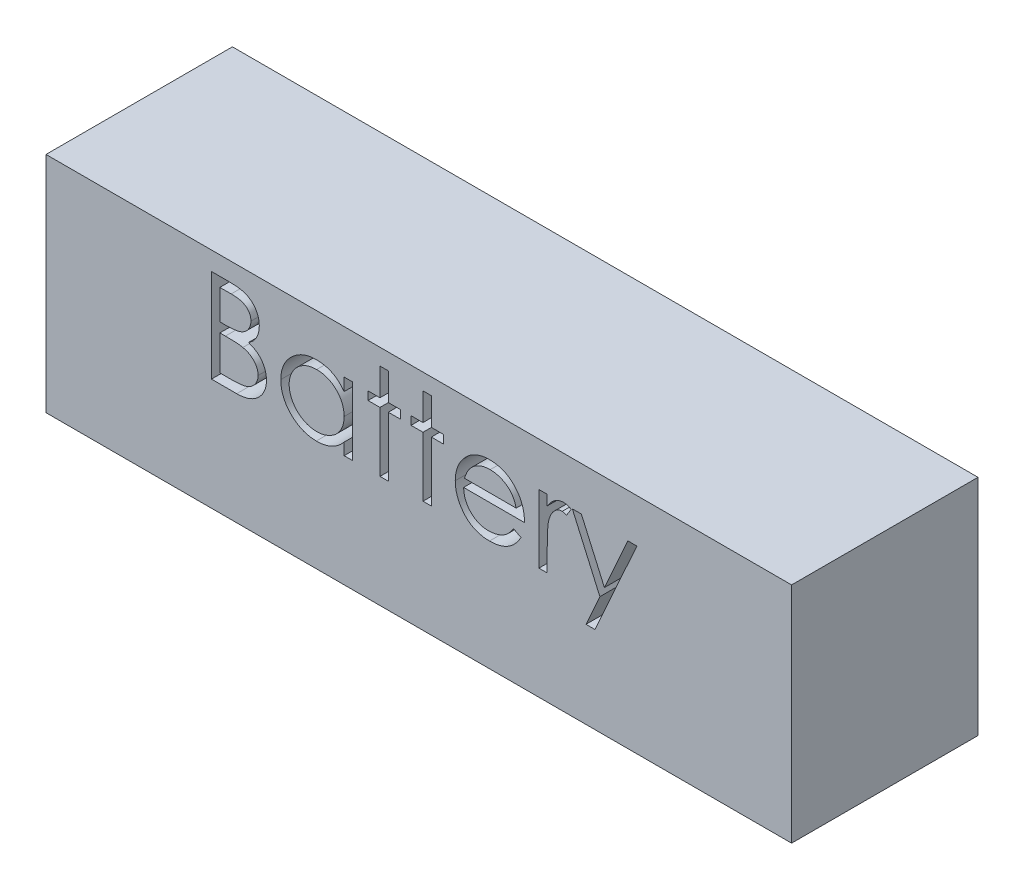
from build123d import *

# Parameters (mm, degrees)
SKETCH1_W           = 101.6
SKETCH1_H           = 30.48
BOSS_EXTRUDE1_DEPTH = 25.4
CUT_EXTRUDE1_DEPTH  = 78.488992395


with BuildPart() as part:
    # Sketch1 → Boss-Extrude1 (new body)
    with BuildSketch(Plane.XY):
        with Locations((3.946640292, 33.362359192)):
            Rectangle(SKETCH1_W, SKETCH1_H)
    extrude(amount=BOSS_EXTRUDE1_DEPTH)

    # Sketch2 → Cut-Extrude1 (cut, through all)
    # profile 1 of 7: a face of its own
    with BuildSketch(Plane.XY.offset(25.4)):
        with BuildLine():
            Line((-24.302718682, 46.062359192), (-21.824794003, 46.062359192))
            add(Edge.make_bspline(
                [(-21.824794003, 46.062359192), (-21.703496382, 46.061721469), (-21.468391404, 46.060485403), (-21.12650943, 46.041315185), (-20.806292317, 46.015176154), (-20.5076472, 45.973701246), (-20.23071208, 45.923656798), (-19.974652368, 45.863053065), (-19.740282314, 45.790385067), (-19.460473242, 45.674828561), (-19.141446844, 45.503113064), (-18.796012676, 45.249372271), (-18.500631579, 44.939011619), (-18.245955513, 44.588917412), (-18.043477165, 44.203796183), (-17.896994286, 43.792827127), (-17.80425571, 43.361311092), (-17.794718249, 43.065062989), (-17.789898169, 42.915343968)],
                knots=[0, 0, 0, 0, 1.001505555, 1.941167018, 2.826882275, 3.653841531, 4.429895133, 5.150066043, 5.825578002, 6.45369114, 7.647487171, 8.808567382, 9.977351308, 11.170798116, 12.373658725, 13.556498008, 14.765093433, 16, 16, 16, 16], degree=3))
            add(Edge.make_bspline(
                [(-17.789898169, 42.915343968), (-17.79386499, 42.775090409), (-17.801660168, 42.499478938), (-17.876201038, 42.096366027), (-17.99289832, 41.712640176), (-18.15511451, 41.349701806), (-18.365941754, 41.015751267), (-18.615799081, 40.708094616), (-18.917249193, 40.439757924), (-19.143103235, 40.289742249), (-19.257826855, 40.213541083)],
                knots=[0, 0, 0, 0, 1.044552857, 2.05264487, 3.044412934, 4.028983338, 5.005914585, 5.980388656, 6.974128949, 8, 8, 8, 8], degree=3))
            add(Edge.make_bspline(
                [(-19.257826855, 40.213541083), (-19.113553304, 40.158150944), (-18.83752226, 40.052175887), (-18.457661587, 39.864812918), (-18.130383149, 39.661024688), (-17.853170648, 39.438477689), (-17.6160883, 39.198597147), (-17.409067626, 38.937865733), (-17.232423783, 38.65288224), (-17.08106546, 38.346617983), (-16.962959974, 38.022200226), (-16.874510264, 37.682671982), (-16.823828377, 37.329250739), (-16.816616079, 37.088729505), (-16.812975092, 36.967307109)],
                knots=[0, 0, 0, 0, 1.27268992, 2.434971085, 3.483601985, 4.442670788, 5.356604649, 6.2567628, 7.179492994, 8.113709626, 9.066344395, 10.018646069, 10.999752585, 12, 12, 12, 12], degree=3))
            add(Edge.make_bspline(
                [(-16.812975092, 36.967307109), (-16.816519648, 36.843330173), (-16.82349366, 36.599402078), (-16.874946701, 36.241062018), (-16.96206546, 35.898615783), (-17.082066477, 35.569848406), (-17.238684019, 35.255395918), (-17.429285489, 34.954902075), (-17.656548592, 34.671386075), (-17.910776716, 34.4016975), (-18.198385073, 34.1592081), (-18.508685098, 33.943251107), (-18.845584601, 33.765646825), (-19.203550408, 33.616454404), (-19.586598069, 33.502491141), (-19.99300753, 33.422762087), (-20.422428283, 33.369040953), (-20.717103665, 33.364624238), (-20.86822349, 33.362359192)],
                knots=[0, 0, 0, 0, 0.978564426, 1.925352924, 2.850884081, 3.763762016, 4.682927383, 5.618979971, 6.567305752, 7.547517671, 8.540179244, 9.531824382, 10.526200242, 11.540722885, 12.589160233, 13.674978461, 14.80764778, 16, 16, 16, 16], degree=3))
            Line((-20.86822349, 33.362359192), (-24.302718682, 33.362359192))
            Line((-24.302718682, 33.362359192), (-24.302718682, 46.062359192))
        make_face()
        with BuildLine():
            Line((-23.162975092, 44.759795089), (-23.162975092, 40.689282269))
            Line((-23.162975092, 40.689282269), (-22.397209868, 40.689282269))
            add(Edge.make_bspline(
                [(-22.397209868, 40.689282269), (-22.285272811, 40.690733418), (-22.068987604, 40.693537334), (-21.755769694, 40.701569239), (-21.465030342, 40.724059282), (-21.197271405, 40.746542862), (-20.952914537, 40.783099223), (-20.732501096, 40.826613497), (-20.532571902, 40.872634324), (-20.302014122, 40.950900748), (-20.040492281, 41.066571169), (-19.761697874, 41.246083261), (-19.515918513, 41.459894485), (-19.308374432, 41.706604546), (-19.138515668, 41.978261849), (-19.02053733, 42.270531958), (-18.940537184, 42.576130723), (-18.93331077, 42.785928383), (-18.929641759, 42.892447333)],
                knots=[0, 0, 0, 0, 1.156816544, 2.235205308, 3.236616184, 4.169592532, 5.011045266, 5.787822928, 6.49130361, 7.128639758, 8.301311294, 9.436451833, 10.541879658, 11.654887649, 12.756523258, 13.837046038, 14.901820046, 16, 16, 16, 16], degree=3))
            add(Edge.make_bspline(
                [(-18.929641759, 42.892447333), (-18.931551041, 42.962935133), (-18.935296307, 43.101204648), (-18.96596972, 43.302769448), (-19.01810349, 43.492339636), (-19.085066211, 43.672513122), (-19.17864231, 43.837656121), (-19.288818305, 43.993478574), (-19.421934953, 44.134673975), (-19.573454345, 44.266643298), (-19.747657062, 44.38364487), (-19.944439178, 44.486118496), (-20.166463035, 44.568635029), (-20.409986823, 44.640902211), (-20.678759055, 44.691659734), (-20.969678148, 44.733944884), (-21.285126986, 44.755472262), (-21.503367787, 44.758322007), (-21.616180221, 44.759795089)],
                knots=[0, 0, 0, 0, 0.91205012, 1.789085906, 2.630437955, 3.453916878, 4.269457761, 5.079663411, 5.91843418, 6.774407191, 7.675494373, 8.627863946, 9.638891023, 10.736472738, 11.911756761, 13.175263542, 14.539845004, 16, 16, 16, 16], degree=3))
            Line((-21.616180221, 44.759795089), (-23.162975092, 44.759795089))
        make_face(mode=Mode.SUBTRACT)
        with BuildLine():
            Line((-23.162975092, 39.386718166), (-23.162975092, 34.664923295))
            Line((-23.162975092, 34.664923295), (-21.539858105, 34.664923295))
            add(Edge.make_bspline(
                [(-21.539858105, 34.664923295), (-21.423675145, 34.666315749), (-21.199747807, 34.668999523), (-20.876437629, 34.677760906), (-20.576778938, 34.697690021), (-20.302139132, 34.729062104), (-20.049552632, 34.763092477), (-19.822049538, 34.80885341), (-19.617785665, 34.861282496), (-19.380933177, 34.942323635), (-19.114220447, 35.068222258), (-18.826798196, 35.258048165), (-18.571251633, 35.484192739), (-18.354243979, 35.745924913), (-18.176396849, 36.030518585), (-18.047018483, 36.332217427), (-17.967223089, 36.646036341), (-17.957563217, 36.860001269), (-17.952718682, 36.967307109)],
                knots=[0, 0, 0, 0, 1.160039823, 2.235823828, 3.228722157, 4.157150951, 4.99529583, 5.772374946, 6.472645482, 7.099169577, 8.269452708, 9.405989375, 10.527446681, 11.663510218, 12.788923519, 13.866172445, 14.929861265, 16, 16, 16, 16], degree=3))
            add(Edge.make_bspline(
                [(-17.952718682, 36.967307109), (-17.953720546, 37.034411516), (-17.955708115, 37.16753793), (-17.985682346, 37.363175331), (-18.029275531, 37.552680642), (-18.085632448, 37.736568444), (-18.1677088, 37.911514123), (-18.263526835, 38.080977697), (-18.375872492, 38.245183179), (-18.550929894, 38.452781927), (-18.805553952, 38.691966517), (-19.167347109, 38.926145454), (-19.57872659, 39.11500464), (-19.877094921, 39.195194168), (-20.031224291, 39.236618006)],
                knots=[0, 0, 0, 0, 0.723448775, 1.435228256, 2.130040452, 2.821711965, 3.505591119, 4.210454504, 4.921174351, 5.648778258, 7.137944449, 8.670945889, 10.280296675, 12, 12, 12, 12], degree=3))
            add(Edge.make_bspline(
                [(-20.031224291, 39.236618006), (-20.093015582, 39.249155025), (-20.226991845, 39.276337868), (-20.445459352, 39.305031535), (-20.694872362, 39.330595038), (-20.975806802, 39.349504095), (-21.288618111, 39.369049554), (-21.633974359, 39.376650762), (-22.010465186, 39.385719505), (-22.271694652, 39.386376764), (-22.40738615, 39.386718166)],
                knots=[0, 0, 0, 0, 0.634451884, 1.375622551, 2.216452059, 3.157844607, 4.20941857, 5.370758133, 6.634282058, 8, 8, 8, 8], degree=3))
            Line((-22.40738615, 39.386718166), (-23.162975092, 39.386718166))
        make_face(mode=Mode.SUBTRACT)
    # profile 2 of 7: a face of its own
    with BuildSketch(Plane.XY.offset(25.4)):
        with BuildLine():
            Line((-5.089898169, 42.643128423), (-5.089898169, 33.362359192))
            Line((-5.089898169, 33.362359192), (-6.229641759, 33.362359192))
            Line((-6.229641759, 33.362359192), (-6.229641759, 34.967667686))
            add(Edge.make_bspline(
                [(-6.229641759, 34.967667686), (-6.358161371, 34.822381159), (-6.608969009, 34.538852675), (-7.027855351, 34.168440221), (-7.471877025, 33.862267454), (-7.938878962, 33.614980617), (-8.428439445, 33.429226584), (-8.939473248, 33.297196807), (-9.47218883, 33.212310605), (-9.83596166, 33.203834183), (-10.020306823, 33.199538679)],
                knots=[0, 0, 0, 0, 1.074387032, 2.096679803, 3.090159297, 4.057316773, 5.018401886, 5.985159533, 6.978961417, 8, 8, 8, 8], degree=3))
            add(Edge.make_bspline(
                [(-10.020306823, 33.199538679), (-10.18420197, 33.203988659), (-10.507410456, 33.212764215), (-10.982858822, 33.280844574), (-11.440393556, 33.390175687), (-11.880447005, 33.542216057), (-12.300171647, 33.743895038), (-12.703161141, 33.98534471), (-13.087327766, 34.272875722), (-13.446815922, 34.601580853), (-13.777857751, 34.958614093), (-14.068365798, 35.339416506), (-14.310584116, 35.742341437), (-14.513131266, 36.162287452), (-14.669146573, 36.602487303), (-14.777908046, 37.061418741), (-14.845909096, 37.538539139), (-14.854681024, 37.863439695), (-14.859128939, 38.028184513)],
                knots=[0, 0, 0, 0, 1.033919861, 2.038935746, 3.024066025, 3.998881131, 4.97069526, 5.957263378, 6.95902576, 7.993208707, 9.027059324, 10.027763471, 11.009749337, 11.988697705, 12.965288445, 13.950418724, 14.960734635, 16, 16, 16, 16], degree=3))
            add(Edge.make_bspline(
                [(-14.859128939, 38.028184513), (-14.854582442, 38.189524237), (-14.845594265, 38.508484168), (-14.778635438, 38.977581158), (-14.666037207, 39.429404561), (-14.508020731, 39.862499755), (-14.305394209, 40.277390795), (-14.058912293, 40.674371114), (-13.768557184, 41.054534356), (-13.433812735, 41.408941379), (-13.071192283, 41.736313322), (-12.683266317, 42.020826144), (-12.279684696, 42.266541567), (-11.854187487, 42.461227038), (-11.413072563, 42.618740075), (-10.952412917, 42.727716845), (-10.474125189, 42.791932839), (-10.149402546, 42.801232012), (-9.984689836, 42.805948936)],
                knots=[0, 0, 0, 0, 1.020392517, 2.01726096, 2.990465484, 3.961182959, 4.928053699, 5.906110375, 6.912531644, 7.948652711, 8.985773172, 9.998621852, 10.987621588, 11.969261332, 12.953316658, 13.946091881, 14.958173133, 16, 16, 16, 16], degree=3))
            add(Edge.make_bspline(
                [(-9.984689836, 42.805948936), (-9.795278919, 42.800731951), (-9.42385305, 42.790501692), (-8.880554273, 42.70536551), (-8.366587168, 42.5615345), (-7.877984233, 42.365891008), (-7.416500029, 42.105908476), (-6.986503486, 41.777958332), (-6.583494447, 41.384108882), (-6.34988596, 41.081593269), (-6.229641759, 40.925880827)],
                knots=[0, 0, 0, 0, 1.038897134, 2.037228247, 3.008116434, 3.962042015, 4.918381754, 5.904844433, 6.921570401, 8, 8, 8, 8], degree=3))
            Line((-6.229641759, 40.925880827), (-6.229641759, 42.643128423))
            Line((-6.229641759, 42.643128423), (-5.089898169, 42.643128423))
        make_face()
        with BuildLine():
            add(Edge.make_bspline(
                [(-9.969425413, 41.666205346), (-10.136028867, 41.660277575), (-10.464877587, 41.648577097), (-10.947637252, 41.557233272), (-11.409603069, 41.405252029), (-11.848464538, 41.197400559), (-12.25728921, 40.936039144), (-12.622663387, 40.619912982), (-12.947575475, 40.257647244), (-13.220836891, 39.85087673), (-13.443596694, 39.414801942), (-13.600231353, 38.958964695), (-13.70353405, 38.491586634), (-13.714087825, 38.174584888), (-13.719385349, 38.01546416)],
                knots=[0, 0, 0, 0, 1.031046209, 2.035121221, 3.029706178, 4.034933723, 5.034054252, 6.02443088, 7.017295772, 8.038157696, 9.050218397, 10.03989886, 11.016116709, 12, 12, 12, 12], degree=3))
            add(Edge.make_bspline(
                [(-13.719385349, 38.01546416), (-13.71261845, 37.857294342), (-13.699111177, 37.54157468), (-13.602044372, 37.073559444), (-13.439194545, 36.617614777), (-13.216973346, 36.177610601), (-12.938710451, 35.769091151), (-12.616171626, 35.399919849), (-12.246237748, 35.082457629), (-11.836472222, 34.816709862), (-11.398837587, 34.602034429), (-10.938611607, 34.452661965), (-10.46444572, 34.35622259), (-10.14203868, 34.344957774), (-9.979601695, 34.339282269)],
                knots=[0, 0, 0, 0, 0.979072187, 1.954306742, 2.945804271, 3.96968567, 4.997920485, 5.998718438, 6.996577872, 8.005894225, 9.015743152, 10.005417472, 10.995077863, 12, 12, 12, 12], degree=3))
            add(Edge.make_bspline(
                [(-9.979601695, 34.339282269), (-9.814695813, 34.345305567), (-9.486714371, 34.357285308), (-9.002522488, 34.449020185), (-8.532640766, 34.600581254), (-8.083469966, 34.810672371), (-7.665037147, 35.071049062), (-7.289487705, 35.375874792), (-6.971929763, 35.730397775), (-6.70271658, 36.120020904), (-6.491622925, 36.547147291), (-6.337858367, 37.001931355), (-6.246948481, 37.484388927), (-6.235490433, 37.814095176), (-6.229641759, 37.982391243)],
                knots=[0, 0, 0, 0, 1.01762866, 2.023962475, 3.030623092, 4.058876274, 5.077231937, 6.066672613, 7.034107872, 8.005628644, 8.981990164, 9.965428785, 10.961468474, 12, 12, 12, 12], degree=3))
            add(Edge.make_bspline(
                [(-6.229641759, 37.982391243), (-6.233123941, 38.110617085), (-6.239977976, 38.363006121), (-6.292340329, 38.733583113), (-6.375633919, 39.088216919), (-6.493004307, 39.427280391), (-6.647186968, 39.748898875), (-6.833143147, 40.055381662), (-7.054142921, 40.345134743), (-7.306628704, 40.614168172), (-7.582999582, 40.859555621), (-7.87544263, 41.07859158), (-8.187422654, 41.258527984), (-8.513693045, 41.407449169), (-8.854819888, 41.525955228), (-9.213578994, 41.605013431), (-9.586157032, 41.659298024), (-9.840324147, 41.663878663), (-9.969425413, 41.666205346)],
                knots=[0, 0, 0, 0, 1.050140795, 2.067009409, 3.05949893, 4.030605086, 5.00011959, 5.97591094, 6.962425594, 7.979863591, 8.993523472, 9.986985069, 10.967611495, 11.937549037, 12.921786183, 13.919465291, 14.943216303, 16, 16, 16, 16], degree=3))
        make_face(mode=Mode.SUBTRACT)
    # profile 3 of 7: a face of its own
    with BuildSketch(Plane.XY.offset(25.4)):
        Polygon((-1.345026374, 46.388000218), (-0.205282785, 46.388000218), (-0.205282785, 42.643128423), (1.422922344, 42.643128423), (1.422922344, 41.503384833), (-0.205282785, 41.503384833), (-0.205282785, 33.362359192), (-1.345026374, 33.362359192), (-1.345026374, 41.503384833), (-2.973231503, 41.503384833), (-2.973231503, 42.643128423), (-1.345026374, 42.643128423), align=None)
    # profile 4 of 7: a face of its own
    with BuildSketch(Plane.XY.offset(25.4)):
        Polygon((4.516512087, 46.388000218), (5.656255677, 46.388000218), (5.656255677, 42.643128423), (7.284460805, 42.643128423), (7.284460805, 41.503384833), (5.656255677, 41.503384833), (5.656255677, 33.362359192), (4.516512087, 33.362359192), (4.516512087, 41.503384833), (2.888306959, 41.503384833), (2.888306959, 42.643128423), (4.516512087, 42.643128423), align=None)
    # profile 5 of 7: a face of its own
    with BuildSketch(Plane.XY.offset(25.4)):
        with BuildLine():
            Line((16.855254074, 36.293128423), (17.867794138, 35.761417686))
            add(Edge.make_bspline(
                [(17.867794138, 35.761417686), (17.787107064, 35.618294741), (17.630121971, 35.339834168), (17.360153543, 34.957267131), (17.077153736, 34.613105419), (16.76834791, 34.316543531), (16.442975075, 34.058002791), (16.09923087, 33.831805541), (15.735325731, 33.639061196), (15.351242444, 33.476673452), (14.943755502, 33.351816145), (14.511877428, 33.263626543), (14.054780859, 33.20911354), (13.741467578, 33.202781172), (13.581035324, 33.199538679)],
                knots=[0, 0, 0, 0, 1.120438281, 2.179929193, 3.190490725, 4.156257408, 5.095198341, 6.022838206, 6.959905092, 7.901321166, 8.864066838, 9.862729781, 10.905609505, 12, 12, 12, 12], degree=3))
            add(Edge.make_bspline(
                [(13.581035324, 33.199538679), (13.402720149, 33.203701287), (13.054878899, 33.211821328), (12.54854896, 33.281825414), (12.071829356, 33.396025115), (11.624746889, 33.555557223), (11.20839643, 33.76393637), (10.821950471, 34.017789347), (10.463376763, 34.3158121), (10.143974632, 34.660586052), (9.856432544, 35.029546297), (9.602701711, 35.414014792), (9.390584747, 35.813024207), (9.218036705, 36.224034394), (9.078681909, 36.644454808), (8.981557012, 37.078110704), (8.92556907, 37.523828396), (8.91698951, 37.825353014), (8.912665933, 37.977303102)],
                knots=[0, 0, 0, 0, 1.145258523, 2.234067595, 3.276747158, 4.290159414, 5.277019952, 6.260822364, 7.254936242, 8.264827045, 9.274100331, 10.257902744, 11.220704747, 12.172965371, 13.118907548, 14.062713208, 15.023725156, 16, 16, 16, 16], degree=3))
            add(Edge.make_bspline(
                [(8.912665933, 37.977303102), (8.916509103, 38.119887201), (8.924125759, 38.402470056), (8.972134616, 38.820719318), (9.057218422, 39.22722256), (9.173972512, 39.622317556), (9.324744176, 40.005342786), (9.509192515, 40.376531359), (9.727604857, 40.735488295), (9.896234273, 40.961922523), (9.981175549, 41.075980987)],
                knots=[0, 0, 0, 0, 1.024358464, 2.0301432, 3.019427413, 4.004406732, 4.986367066, 5.972626655, 6.978780325, 8, 8, 8, 8], degree=3))
            add(Edge.make_bspline(
                [(9.981175549, 41.075980987), (10.09622914, 41.213390887), (10.322691718, 41.48385789), (10.705710493, 41.839234101), (11.12045692, 42.136935799), (11.561733392, 42.38370455), (12.034668598, 42.571206069), (12.532905168, 42.710933582), (13.062116295, 42.789230936), (13.423903811, 42.800290218), (13.6090201, 42.805948936)],
                knots=[0, 0, 0, 0, 1.030682036, 2.02871468, 2.997146059, 3.962720338, 4.930598197, 5.918074684, 6.934738563, 8, 8, 8, 8], degree=3))
            add(Edge.make_bspline(
                [(13.6090201, 42.805948936), (13.799329982, 42.801035673), (14.172674589, 42.79139697), (14.717076856, 42.70203856), (15.232191457, 42.560333577), (15.717812258, 42.360204108), (16.173988495, 42.101996592), (16.597755018, 41.782167624), (16.996359078, 41.410536279), (17.228255921, 41.124738348), (17.346259683, 40.979306307)],
                knots=[0, 0, 0, 0, 1.056321875, 2.072262726, 3.055038591, 4.01806755, 4.982017516, 5.957941055, 6.960871419, 8, 8, 8, 8], degree=3))
            add(Edge.make_bspline(
                [(17.346259683, 40.979306307), (17.426548859, 40.869710455), (17.586592783, 40.651248253), (17.787060832, 40.295027197), (17.961077665, 39.922334469), (18.100171552, 39.527145677), (18.212800599, 39.1141432), (18.29428677, 38.680374538), (18.342073672, 38.22596886), (18.351466945, 37.916355358), (18.356255677, 37.758513038)],
                knots=[0, 0, 0, 0, 0.94817472, 1.890038105, 2.849395472, 3.817997239, 4.812318967, 5.836947057, 6.897266129, 8, 8, 8, 8], degree=3))
            Line((18.356255677, 37.758513038), (10.052409523, 37.758513038))
            add(Edge.make_bspline(
                [(10.052409523, 37.758513038), (10.057996095, 37.636228496), (10.068981863, 37.395760877), (10.120199668, 37.043895464), (10.200930933, 36.708712194), (10.314392961, 36.392725156), (10.451795513, 36.091807265), (10.6201094, 35.808190731), (10.820912924, 35.543167385), (11.044889034, 35.294366628), (11.294197637, 35.072803295), (11.556480748, 34.874495421), (11.835494541, 34.708286541), (12.129039015, 34.573376656), (12.436639493, 34.467762309), (12.758392887, 34.395670502), (13.093666052, 34.347384715), (13.322214286, 34.342015644), (13.438567376, 34.339282269)],
                knots=[0, 0, 0, 0, 1.094153842, 2.151609401, 3.174256925, 4.172055639, 5.149267565, 6.128595816, 7.11444997, 8.118368179, 9.117203808, 10.09244225, 11.054858984, 12.015122123, 12.976791628, 13.957293641, 14.960065497, 16, 16, 16, 16], degree=3))
            add(Edge.make_bspline(
                [(13.438567376, 34.339282269), (13.552327254, 34.341488646), (13.778048675, 34.345866521), (14.114202643, 34.388436598), (14.444908929, 34.457271598), (14.768798782, 34.551215276), (15.079298709, 34.66579414), (15.366846848, 34.80405308), (15.631297916, 34.956996447), (15.878465194, 35.131928697), (16.118208513, 35.346044118), (16.356034107, 35.613236591), (16.611037963, 35.929239906), (16.770657343, 36.167077037), (16.855254074, 36.293128423)],
                knots=[0, 0, 0, 0, 0.99110716, 1.966546729, 2.947904876, 3.932708344, 4.903319531, 5.828989031, 6.710028674, 7.56322171, 8.463672341, 9.504779593, 10.677557249, 12, 12, 12, 12], degree=3))
        make_face()
        with BuildLine():
            add(Edge.make_bspline(
                [(17.216512087, 38.898256628), (17.174795764, 39.049433341), (17.09450527, 39.34039985), (16.926733319, 39.743319653), (16.737788014, 40.101415751), (16.51418916, 40.411947562), (16.260846927, 40.687731738), (15.968220122, 40.928736318), (15.640067022, 41.144336783), (15.278083855, 41.32631871), (14.894755092, 41.481221912), (14.493412624, 41.585090189), (14.083900079, 41.656244814), (13.806915669, 41.662870979), (13.667533722, 41.666205346)],
                knots=[0, 0, 0, 0, 1.154881502, 2.222775134, 3.210006277, 4.132804581, 5.035138423, 5.962687519, 6.919655026, 7.923214229, 8.944639381, 9.960483929, 10.97369054, 12, 12, 12, 12], degree=3))
            add(Edge.make_bspline(
                [(13.667533722, 41.666205346), (13.553780045, 41.663985852), (13.328912941, 41.659598379), (12.997620494, 41.617978196), (12.679468443, 41.549181044), (12.372109257, 41.454965345), (12.079570677, 41.329385558), (11.795835376, 41.182126422), (11.528117938, 41.002361246), (11.360690951, 40.865350544), (11.27610744, 40.796133231)],
                knots=[0, 0, 0, 0, 1.04873581, 2.073130211, 3.073294108, 4.04793562, 5.032784715, 6.005352987, 6.992311501, 8, 8, 8, 8], degree=3))
            add(Edge.make_bspline(
                [(11.27610744, 40.796133231), (11.215534674, 40.741362428), (11.092950158, 40.630519673), (10.929154552, 40.439550837), (10.772325979, 40.233623741), (10.629601011, 40.004860003), (10.498690911, 39.755864605), (10.376190423, 39.488737757), (10.265931156, 39.201452398), (10.203896699, 39.001255262), (10.171980837, 38.898256628)],
                knots=[0, 0, 0, 0, 0.879870761, 1.780643979, 2.707998968, 3.669668524, 4.684282772, 5.740141944, 6.837334558, 8, 8, 8, 8], degree=3))
            Line((10.171980837, 38.898256628), (17.216512087, 38.898256628))
        make_face(mode=Mode.SUBTRACT)
    # profile 6 of 7: a face of its own
    with BuildSketch(Plane.XY.offset(25.4)):
        with BuildLine():
            Line((20.310101831, 42.643128423), (21.44984542, 42.643128423))
            Line((21.44984542, 42.643128423), (21.44984542, 41.276962557))
            add(Edge.make_bspline(
                [(21.44984542, 41.276962557), (21.533987488, 41.404165134), (21.694908538, 41.647439075), (21.962381168, 41.969181967), (22.236350398, 42.235573708), (22.518127792, 42.447857904), (22.809785469, 42.606836935), (23.104922408, 42.723288805), (23.40818197, 42.792149349), (23.611969524, 42.801342912), (23.714068177, 42.805948936)],
                knots=[0, 0, 0, 0, 1.2804753, 2.448899062, 3.506932113, 4.484331642, 5.4025378, 6.288909075, 7.142734305, 8, 8, 8, 8], degree=3))
            add(Edge.make_bspline(
                [(23.714068177, 42.805948936), (23.793266562, 42.801629025), (23.956222385, 42.792740528), (24.202902068, 42.730289821), (24.457059736, 42.630583854), (24.620862113, 42.53682076), (24.706255677, 42.487940122)],
                knots=[0, 0, 0, 0, 0.901110191, 1.854092781, 2.881294221, 4, 4, 4, 4], degree=3))
            Line((24.706255677, 42.487940122), (24.080414331, 41.500840763))
            add(Edge.make_bspline(
                [(24.080414331, 41.500840763), (24.025590168, 41.5252983), (23.921523413, 41.571723387), (23.769288272, 41.626667252), (23.628930279, 41.65901929), (23.539509367, 41.663920465), (23.497822183, 41.666205346)],
                knots=[0, 0, 0, 0, 1.180555205, 2.24091978, 3.179933427, 4, 4, 4, 4], degree=3))
            add(Edge.make_bspline(
                [(23.497822183, 41.666205346), (23.406361379, 41.66010921), (23.21980785, 41.647674861), (22.945906952, 41.549925473), (22.680124235, 41.39199103), (22.469044203, 41.216835853), (22.305605171, 41.047933845), (22.188982067, 40.900438212), (22.082001813, 40.735052892), (21.979784157, 40.554605183), (21.886652175, 40.356014027), (21.799730947, 40.14126351), (21.721140215, 39.9101049), (21.676326472, 39.749059755), (21.653371061, 39.666565923)],
                knots=[0, 0, 0, 0, 1.125678352, 2.296057538, 3.5422874, 4.923748041, 5.663163013, 6.437101912, 7.23742474, 8.08941207, 8.991984279, 9.93940061, 10.944477711, 12, 12, 12, 12], degree=3))
            add(Edge.make_bspline(
                [(21.653371061, 39.666565923), (21.636199234, 39.59298875), (21.598164941, 39.430020904), (21.561184218, 39.1566134), (21.524646253, 38.833584695), (21.498895667, 38.460035629), (21.475026771, 38.036899047), (21.461564472, 37.56353033), (21.450304505, 37.039443599), (21.450003091, 36.673050946), (21.44984542, 36.481389641)],
                knots=[0, 0, 0, 0, 0.566838948, 1.255505196, 2.06880316, 3.007127437, 4.065329342, 5.249902469, 6.561414163, 8, 8, 8, 8], degree=3))
            Line((21.44984542, 36.481389641), (21.44984542, 33.362359192))
            Line((21.44984542, 33.362359192), (20.310101831, 33.362359192))
            Line((20.310101831, 33.362359192), (20.310101831, 42.643128423))
        make_face()
    # profile 7 of 7: a face of its own
    with BuildSketch(Plane.XY.offset(25.4)):
        Polygon((24.86907619, 42.643128423), (26.097862247, 42.643128423), (29.239789331, 35.53499541), (32.430053754, 42.643128423), (33.661383882, 42.643128423), (27.962665933, 29.943128423), (26.731335805, 29.943128423), (28.621580196, 34.153565122), align=None)
    extrude(amount=-CUT_EXTRUDE1_DEPTH, mode=Mode.SUBTRACT)


with BuildPart() as cut_extrude1_piece_1:
    # of the separate pieces the step leaves, piece 1, a body of its own (cut_extrude1_pieces)
    add(part.part.solids().sort_by_distance((-46.853359708, 48.602359192, 0))[0])


with BuildPart() as cut_extrude1_piece_2:
    # of the separate pieces the step leaves, piece 2, a body of its own (cut_extrude1_pieces)
    add(part.part.solids().sort_by_distance((-9.979601695, 34.339282269, 0))[0])


with BuildPart() as cut_extrude1_piece_3:
    # of the separate pieces the step leaves, piece 3, a body of its own (cut_extrude1_pieces)
    add(part.part.solids().sort_by_distance((-21.539858105, 34.664923295, 0))[0])


with BuildPart() as cut_extrude1_piece_4:
    # of the separate pieces the step leaves, piece 4, a body of its own (cut_extrude1_pieces)
    add(part.part.solids().sort_by_distance((-22.397209868, 40.689282269, 0))[0])


with BuildPart() as cut_extrude1_piece_5:
    # of the separate pieces the step leaves, piece 5, a body of its own (cut_extrude1_pieces)
    add(part.part.solids().sort_by_distance((11.27610744, 40.796133231, 0))[0])


solid = Compound([cut_extrude1_piece_1.part, cut_extrude1_piece_2.part, cut_extrude1_piece_3.part, cut_extrude1_piece_4.part, cut_extrude1_piece_5.part])
